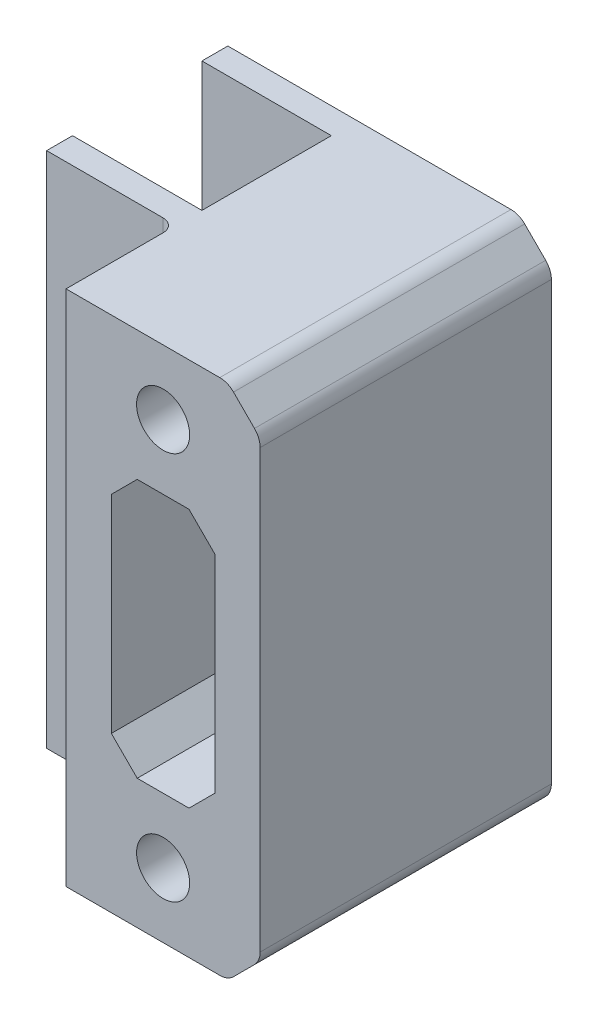
from build123d import *

# Parameters (mm, degrees)
CROQUIS1_R              = 4.1
SALIENTE_EXTRUIR1_DEPTH = 22.5
CROQUIS2_W              = 20
CROQUIS2_H              = 4
SALIENTE_EXTRUIR2_DEPTH = 80
REDONDEO1_R             = 2
CROQUIS3_R              = 4.1
SALIENTE_EXTRUIR3_DEPTH = 25


with BuildPart() as part:
    # Croquis1 → Saliente-Extruir1 (new, symmetric)
    with BuildSketch(Plane.XY):
        with BuildLine():
            Line((14.121320343, 35.878679656), (10.878679656, 39.121320344))
            ThreePointArc((10.878679656, 39.121320344), (9.90540961, 39.771638598), (8.757359313, 40))
            Line((8.757359313, 40), (-15, 40))
            Line((-15, 40), (-15, -40))
            Line((-15, -40), (8.757359313, -40))
            ThreePointArc((8.757359313, -40), (9.90540961, -39.771638598), (10.878679656, -39.121320344))
            Line((10.878679656, -39.121320344), (14.121320343, -35.878679656))
            ThreePointArc((14.121320343, -35.878679656), (14.771638597, -34.90540961), (15, -33.757359313))
            Line((15, -33.757359313), (15, 33.757359313))
            ThreePointArc((15, 33.757359313), (14.771638597, 34.90540961), (14.121320343, 35.878679656))
        make_face()
        with Locations(Location((0, 30, 0), (0, 0, 180))):
            Circle(CROQUIS1_R, mode=Mode.SUBTRACT)
        with Locations(Location((0, -30, 0), (0, 0, 180))):
            Circle(CROQUIS1_R, mode=Mode.SUBTRACT)
        Polygon((-4, -20), (-8, -16), (-8, 16), (-4, 20), (4, 20), (8, 16), (8, -16), (4, -20), align=None, mode=Mode.SUBTRACT)
    extrude(amount=SALIENTE_EXTRUIR1_DEPTH, both=True)

    # Croquis2 → Saliente-Extruir2 (add)
    with BuildSketch(Plane(origin=(0, 40, 0), x_dir=(1, 0, 0), z_dir=(0, 1, 0))):
        with Locations((-25, 20.5)):
            Rectangle(CROQUIS2_W, CROQUIS2_H)
        with Locations((-25, -3.5)):
            Rectangle(CROQUIS2_W, CROQUIS2_H)
    extrude(amount=-SALIENTE_EXTRUIR2_DEPTH)

    # Redondeo1
    redondeo1_edges = [part.edges().sort_by_distance(p)[0] for p in [
        (-15, 0, 5.5),
    ]]
    fillet(redondeo1_edges, radius=REDONDEO1_R)

    # Croquis3 → Saliente-Extruir3 (add)
    with BuildSketch(Plane(origin=(0, 0, -22.5), x_dir=(-1, 0, 0), z_dir=(0, 0, -1))):
        with Locations((0, -30)):
            Circle(CROQUIS3_R)
        with Locations((0, 30)):
            Circle(CROQUIS3_R)
    extrude(amount=-SALIENTE_EXTRUIR3_DEPTH)


solid = part.part
